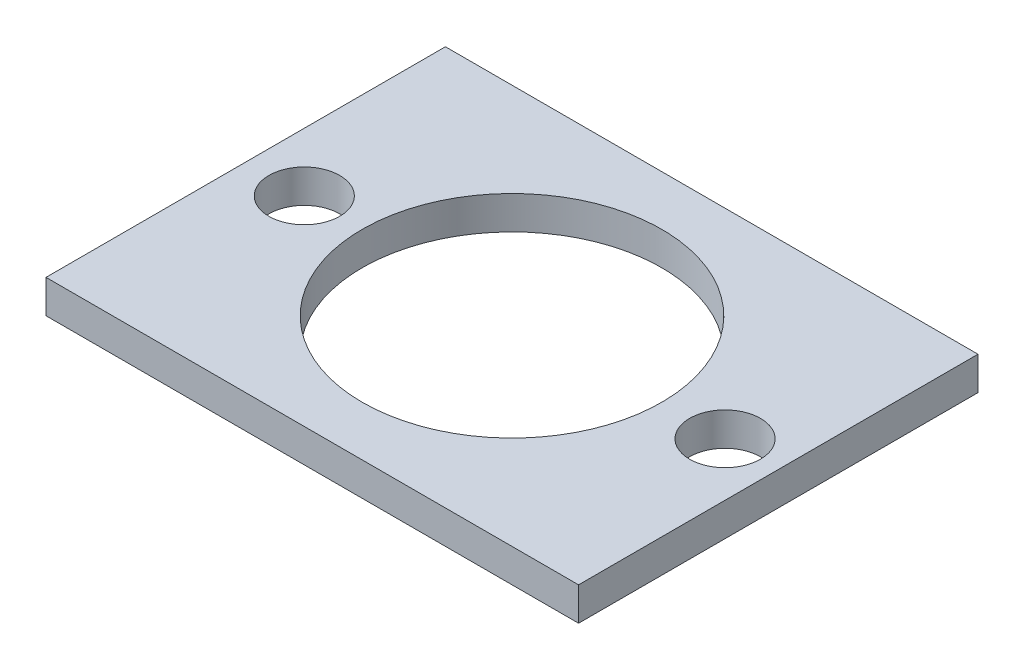
from build123d import *

# Parameters (mm, degrees)
SKETCH1_W               = 50.8
SKETCH1_H               = 38.1
SKETCH1_R               = 14.2875
BOSS_EXTRUDE1_DEPTH     = 3.175
F_1_4_CLEARANCE_HOLE1_D = 6.7564


with BuildPart() as part:
    # Sketch1 → Boss-Extrude1 (new body)
    with BuildSketch(Plane(origin=(0, 0, 0), x_dir=(1, 0, 0), z_dir=(0, 1, 0))):
        Rectangle(SKETCH1_W, SKETCH1_H)
        with Locations(Location((0, 0, 0), (0, 0, 270))):
            Circle(SKETCH1_R, mode=Mode.SUBTRACT)
    extrude(amount=BOSS_EXTRUDE1_DEPTH)

    # 1/4 Clearance Hole1 (through all)
    with Locations(Plane(origin=(0, 3.175, 0), x_dir=(1, 0, 0), z_dir=(0, 1, 0))):
        with Locations((20.32, 0), (-19.812, 0)):
            Hole(F_1_4_CLEARANCE_HOLE1_D / 2)


solid = part.part
